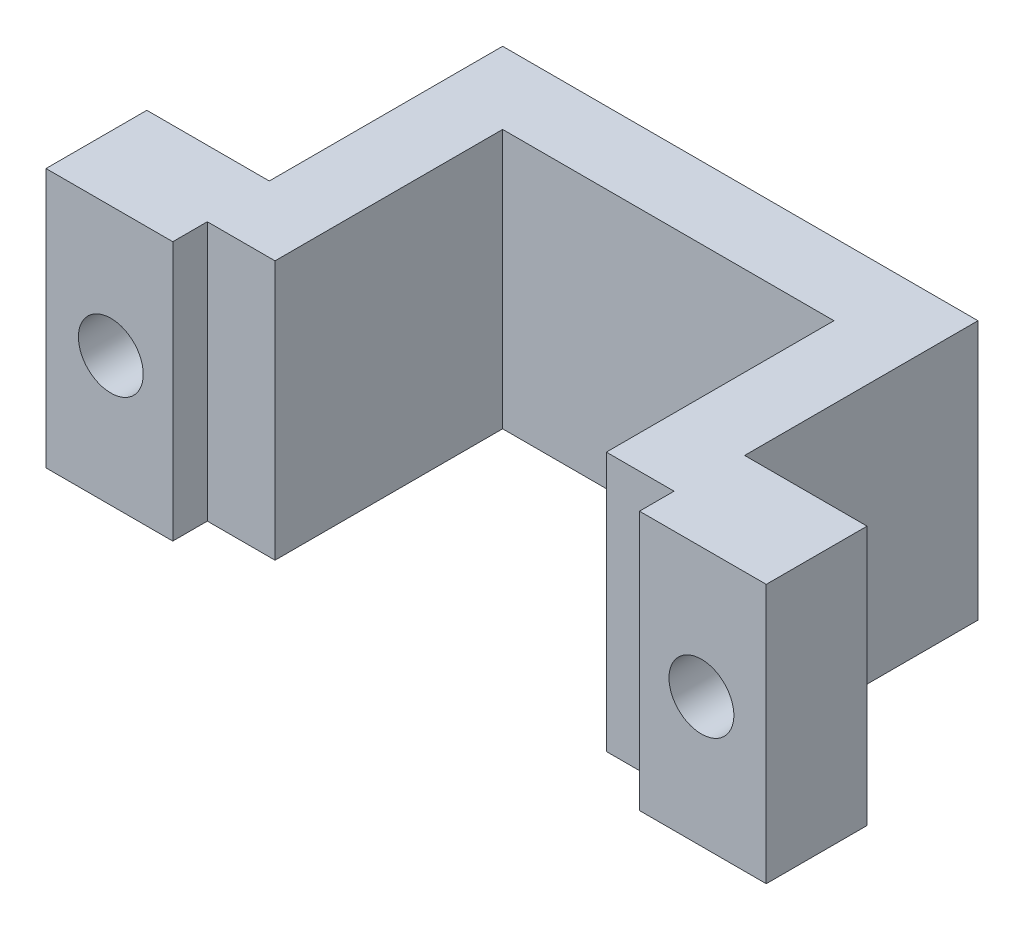
from build123d import *

# Parameters (mm, degrees)
BOSS_EXTRUDE1_DEPTH = 18
SKETCH2_R           = 2.25
CUT_EXTRUDE1_DEPTH  = 56.555737777


with BuildPart() as part:
    # Sketch1 → Boss-Extrude1 (new body)
    with BuildSketch(Plane(origin=(0, 0, 0), x_dir=(1, 0, 0), z_dir=(0, 1, 0))):
        Polygon((0, 0), (8.8, 0), (8.8, 2.4), (13.5, 2.4), (13.5, 18.2), (36.5, 18.2), (36.5, 2.4), (41.2, 2.4), (41.2, 0), (50, 0), (50, 7), (41.5, 7), (41.5, 23.2), (8.5, 23.2), (8.5, 7), (0, 7), align=None)
    extrude(amount=BOSS_EXTRUDE1_DEPTH)

    # Sketch2 → Cut-Extrude1 (cut, through all)
    with BuildSketch(Plane(origin=(0, 0, -7), x_dir=(-1, 0, 0), z_dir=(0, 0, -1))):
        with Locations((-45.5, 9)):
            Circle(SKETCH2_R)
        with Locations(Location((-4.5, 9, 0), (0, 0, 180))):
            Circle(SKETCH2_R)
    extrude(amount=-CUT_EXTRUDE1_DEPTH, mode=Mode.SUBTRACT)


solid = part.part
